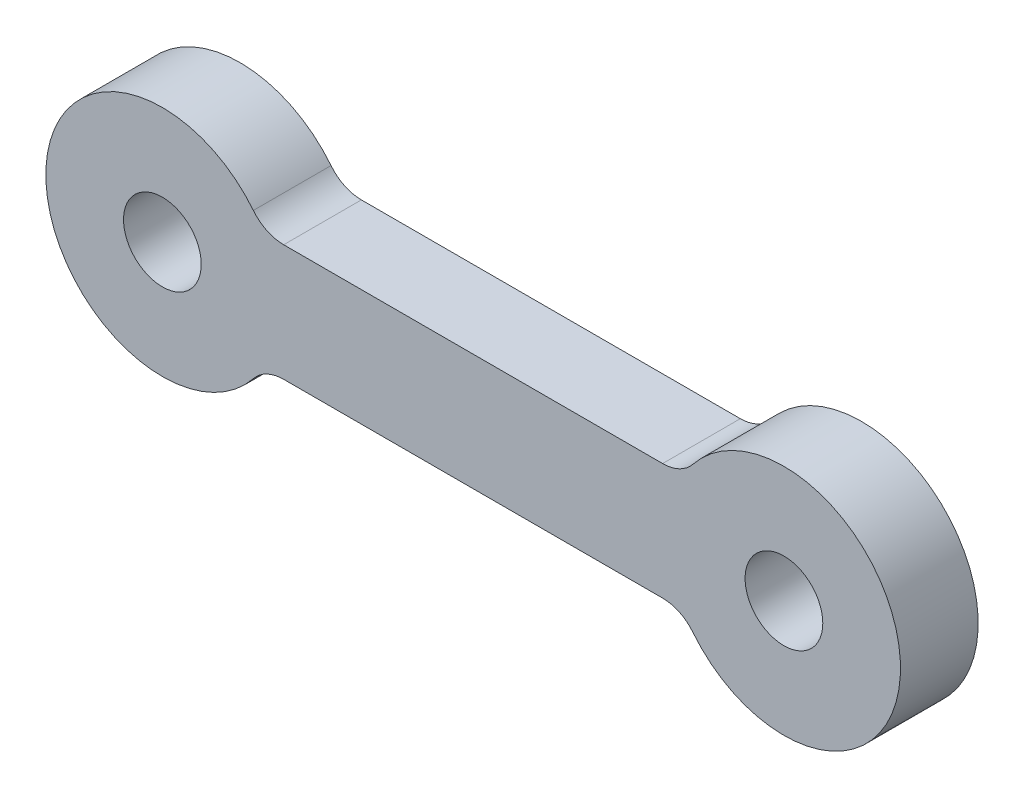
from build123d import *

# Parameters (mm, degrees)
SKETCH1_R           = 6.35
BOSS_EXTRUDE1_DEPTH = 12.7
FILLET1_R           = 6.35


with BuildPart() as part:
    # Sketch1 → Boss-Extrude1 (new body)
    with BuildSketch(Plane.XY):
        with BuildLine():
            Line((-85.102216058, -9.525), (-16.497783942, -9.525))
            ThreePointArc((-16.497783942, -9.525), (19.05, 0), (-16.497783942, 9.525))
            Line((-16.497783942, 9.525), (-85.102216058, 9.525))
            ThreePointArc((-85.102216058, 9.525), (-120.65, 0), (-85.102216058, -9.525))
        make_face()
        Circle(SKETCH1_R, mode=Mode.SUBTRACT)
        with Locations((-101.6, 0)):
            Circle(SKETCH1_R, mode=Mode.SUBTRACT)
    extrude(amount=BOSS_EXTRUDE1_DEPTH)

    # Fillet1
    fillet1_edges = [part.edges().sort_by_distance(p)[0] for p in [
        (-85.102216058, 9.525, 6.35),
        (-16.497783942, 9.525, 6.35),
        (-16.497783942, -9.525, 6.35),
        (-85.102216058, -9.525, 6.35),
    ]]
    fillet(fillet1_edges, radius=FILLET1_R)


solid = part.part
